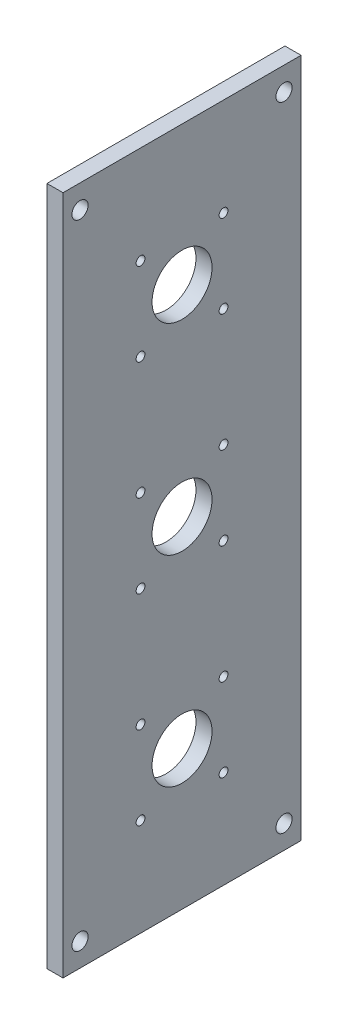
from build123d import *

# Parameters (mm, degrees)
SKETCH1_W              = 254
SKETCH1_H              = 88.9
BOSS_EXTRUDE1_DEPTH    = 6
F_10_CLEARANCE_HOLE1_D = 6.0452
SKETCH4_R              = 11.2
SKETCH4_R_2            = 1.65
CUT_EXTRUDE1_DEPTH     = 135.687796403


with BuildPart() as part:
    # Sketch1 → Boss-Extrude1 (new body)
    with BuildSketch(Plane.YZ):
        Rectangle(SKETCH1_W, SKETCH1_H)
    extrude(amount=-BOSS_EXTRUDE1_DEPTH)

    # #10 Clearance Hole1 (through all)
    with Locations(Plane.YZ):
        with Locations((118.2625, 38.1), (-118.2625, 38.1), (-118.2625, -38.1), (118.2625, -38.1)):
            Hole(F_10_CLEARANCE_HOLE1_D / 2)

    # Sketch4 → Cut-Extrude1 (cut, through all)
    with BuildSketch(Plane.YZ):
        with Locations(Location((0, 0, 0), (0, 0, 270))):
            Circle(SKETCH4_R)
        with Locations(Location((-15.5, 15.5, 0), (0, 0, 270))):
            Circle(SKETCH4_R_2)
        with Locations(Location((15.5, 15.5, 0), (0, 0, 90))):
            Circle(SKETCH4_R_2)
        with Locations(Location((15.5, -15.5, 0), (0, 0, 270))):
            Circle(SKETCH4_R_2)
        with Locations(Location((-15.5, -15.5, 0), (0, 0, 90))):
            Circle(SKETCH4_R_2)
        with Locations(Location((75, 0, 0), (0, 0, 270))):
            Circle(SKETCH4_R)
        with Locations(Location((59.5, 15.5, 0), (0, 0, 270))):
            Circle(SKETCH4_R_2)
        with Locations(Location((90.5, 15.5, 0), (0, 0, 90))):
            Circle(SKETCH4_R_2)
        with Locations(Location((90.5, -15.5, 0), (0, 0, 270))):
            Circle(SKETCH4_R_2)
        with Locations(Location((59.5, -15.5, 0), (0, 0, 90))):
            Circle(SKETCH4_R_2)
        with Locations(Location((-75, 0, 0), (0, 0, 270))):
            Circle(SKETCH4_R)
        with Locations(Location((-90.5, -15.5, 0), (0, 0, 90))):
            Circle(SKETCH4_R_2)
        with Locations(Location((-59.5, -15.5, 0), (0, 0, 270))):
            Circle(SKETCH4_R_2)
        with Locations(Location((-59.5, 15.5, 0), (0, 0, 90))):
            Circle(SKETCH4_R_2)
        with Locations(Location((-90.5, 15.5, 0), (0, 0, 270))):
            Circle(SKETCH4_R_2)
    extrude(amount=-CUT_EXTRUDE1_DEPTH, mode=Mode.SUBTRACT)


solid = part.part
